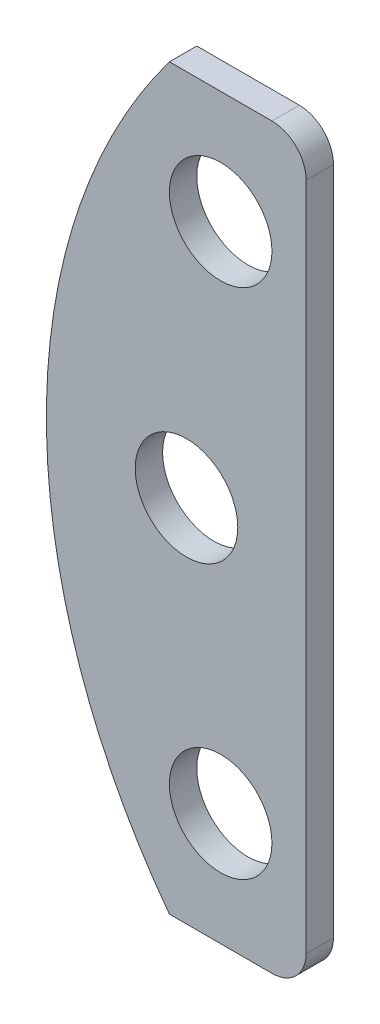
from build123d import *

# Parameters (mm, degrees)
RESSALTO_EXTRUS_O1_DEPTH = 4
ESBO_O2_R                = 7.5
CORTE_EXTRUS_O1_DEPTH    = 10
FILETE1_R                = 5


with BuildPart() as part:
    # Esboço1 → Ressalto-extrusão1 (new body)
    with BuildSketch(Plane.XY):
        with BuildLine():
            Line((-72, -54), (-52, -54))
            Line((-52, -54), (-52, 54))
            Line((-52, 54), (-72, 54))
            ThreePointArc((-72, 54), (-90, 0), (-72, -54))
        make_face()
    extrude(amount=RESSALTO_EXTRUS_O1_DEPTH)

    # Esboço2 → Corte-extrusão1 (cut)
    with BuildSketch(Plane(origin=(0, 0, 0), x_dir=(-1, 0, 0), z_dir=(0, 0, -1))):
        with Locations((69.5, 0)):
            Circle(ESBO_O2_R)
        with Locations((64.5, -37.5)):
            Circle(ESBO_O2_R)
        with Locations((64.5, 37.5)):
            Circle(ESBO_O2_R)
    extrude(amount=-CORTE_EXTRUS_O1_DEPTH, mode=Mode.SUBTRACT)

    # Filete1
    filete1_edges = [part.edges().sort_by_distance(p)[0] for p in [
        (-52, 54, 2),
        (-52, -54, 2),
    ]]
    fillet(filete1_edges, radius=FILETE1_R)


solid = part.part
